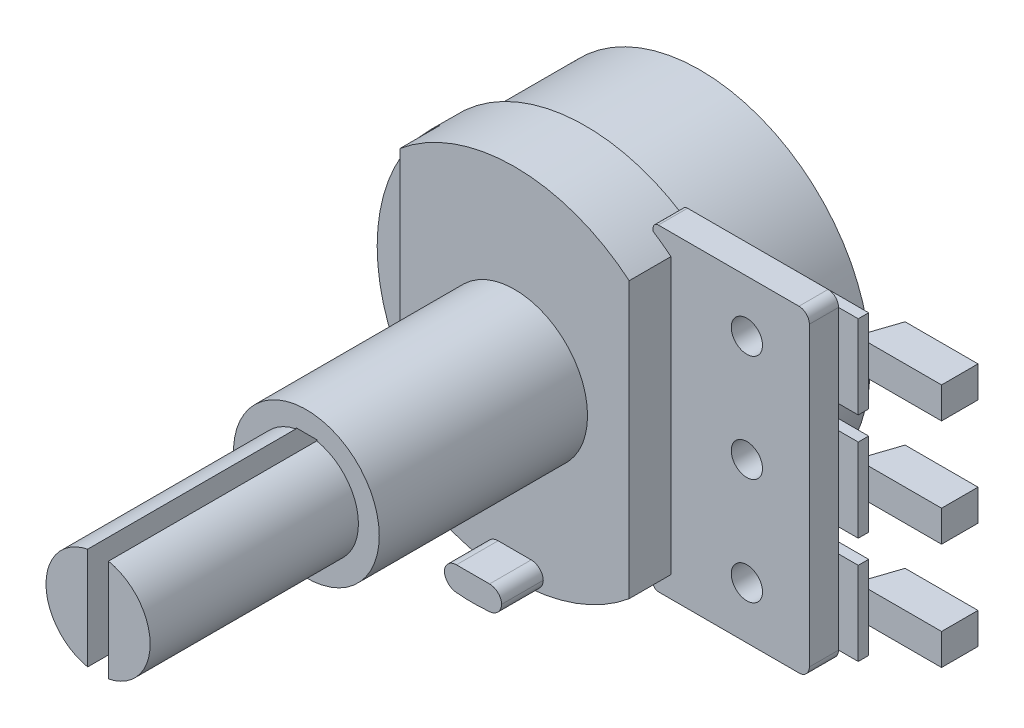
from build123d import *
from build123d.topology import SkipClean

# Parameters (mm, degrees)
SKETCH_2_R          = 8.175
EXTRUDE_1_DEPTH     = 5.5
EXTRUDE_2_DEPTH     = 1.4
SKETCH_5_W          = 2.5
SKETCH_5_H          = 2.5
CUT_EXTRUDE_1_DEPTH = 2.5
EXTRUDE_3_DEPTH     = 2
SKETCH_7_R          = 3.5
EXTRUDE_4_DEPTH     = 10
SKETCH_8_R          = 2.5
EXTRUDE_5_DEPTH     = 10
SKETCH_9_W          = 1
SKETCH_9_H          = 5
CUT_EXTRUDE_5_DEPTH = 11.5
EXTRUDE_START       = 0.5
EXTRUDE_6_DEPTH     = 0.5
SKETCH_14_W         = 4
SKETCH_14_H         = 1.5
EXTRUDE_7_DEPTH     = 1.75
EXTRUDE_7_2_DEPTH   = 1.75
EXTRUDE_7_3_DEPTH   = 1.75
SKETCH_11_R         = 0.75
CUT_EXTRUDE_6_DEPTH = 1.9
CHAMFER_1_SIZE      = 1.5
CHAMFER_1_SIZE2     = 0.5
CHAMFER_2_SIZE      = 1.5
CHAMFER_2_SIZE2     = 0.5
CHAMFER_3_SIZE      = 1.5
CHAMFER_3_SIZE2     = 0.5
EXTRUDE_8_DEPTH     = 2


with BuildPart() as part:
    # Эскиз2 → Бобышка-Вытянуть1 (new body)
    with BuildSketch(Plane.XY):
        Circle(SKETCH_2_R)
    extrude(amount=EXTRUDE_1_DEPTH)

    # Эскиз3 → Бобышка-Вытянуть2 (add)
    with BuildSketch(Plane.XY.offset(5.5)):
        with BuildLine():
            Line((4.65, -7.375), (4.65, -7.234466117))
            ThreePointArc((4.65, -7.234466117), (-8.6, 0), (4.65, 7.234466117))
            Line((4.65, 7.234466117), (4.65, 7.375))
            ThreePointArc((4.65, 7.375), (4.723223305, 7.551776695), (4.9, 7.625))
            Line((4.9, 7.625), (11.65, 7.625))
            ThreePointArc((11.65, 7.625), (12.003553391, 7.478553391), (12.15, 7.125))
            Line((12.15, 7.125), (12.15, -7.125))
            ThreePointArc((12.15, -7.125), (12.003553391, -7.478553391), (11.65, -7.625))
            Line((11.65, -7.625), (4.9, -7.625))
            ThreePointArc((4.9, -7.625), (4.723223305, -7.551776695), (4.65, -7.375))
        make_face()
    extrude(amount=EXTRUDE_2_DEPTH)

    # Эскиз5 → Вырез-Вытянуть1 (cut)
    with BuildSketch(Plane(origin=(0, 0, 0), x_dir=(-1, 0, 0), z_dir=(0, 0, -1))):
        with Locations((0, -6.925)):
            Rectangle(SKETCH_5_W, SKETCH_5_H)
    extrude(amount=-CUT_EXTRUDE_1_DEPTH, mode=Mode.SUBTRACT)

    # Эскиз6 → Бобышка-Вытянуть3 (add)
    with SkipClean():  # the faces are left unmerged after this step: merging them gives an invalid solid
        with BuildSketch(Plane.XY.offset(6.9)):
            with BuildLine():
                Line((-5.5, 6.61135387), (-5.5, -6.61135387))
                ThreePointArc((-5.5, -6.61135387), (0, -8.6), (5.5, -6.61135387))
                Line((5.5, -6.61135387), (5.5, 6.61135387))
                ThreePointArc((5.5, 6.61135387), (0, 8.6), (-5.5, 6.61135387))
            make_face()
        extrude(amount=EXTRUDE_3_DEPTH)

    # Эскиз7 → Бобышка-Вытянуть4 (add)
    with SkipClean():  # the faces are left unmerged after this step: merging them gives an invalid solid
        with BuildSketch(Plane.XY.offset(8.9)):
            Circle(SKETCH_7_R)
        extrude(amount=EXTRUDE_4_DEPTH)

    # Эскиз8 → Бобышка-Вытянуть5 (add)
    with SkipClean():  # the faces are left unmerged after this step: merging them gives an invalid solid
        with BuildSketch(Plane.XY.offset(18.9)):
            Circle(SKETCH_8_R)
        extrude(amount=EXTRUDE_5_DEPTH)

    # Эскиз9 → Вырез-Вытянуть5 (cut)
    with SkipClean():  # the faces are left unmerged after this step: merging them gives an invalid solid
        with BuildSketch(Plane.XY.offset(28.9)):
            Rectangle(SKETCH_9_W, SKETCH_9_H)
        extrude(amount=-CUT_EXTRUDE_5_DEPTH, mode=Mode.SUBTRACT)

    # Эскиз12 → Бобышка-Вытянуть6 (add)
    with SkipClean():  # the faces are left unmerged after this step: merging them gives an invalid solid
        with BuildSketch(Plane(origin=(0, 0, 5.5), x_dir=(-1, 0, 0), z_dir=(0, 0, -1)).offset(EXTRUDE_START)):
            with BuildLine():
                Line((-9.15, -2), (-13.095809491, -2))
                Line((-13.095809491, -2), (-13.095809491, 2))
                Line((-13.095809491, 2), (-9.15, 2))
                ThreePointArc((-9.15, 2), (-8.551799079, 1.908443255), (-8.008367486, 1.642155658))
                ThreePointArc((-8.008367486, 1.642155658), (-8.175, 0), (-8.008367486, -1.642155658))
                ThreePointArc((-8.008367486, -1.642155658), (-8.551799079, -1.908443255), (-9.15, -2))
            make_face()
            with BuildLine():
                Line((-9.15, 7.125860343), (-13.095809491, 7.125860343))
                Line((-13.095809491, 7.125860343), (-13.095809491, 3.125860343))
                Line((-13.095809491, 3.125860343), (-9.15, 3.125860343))
                ThreePointArc((-9.15, 3.125860343), (-7.15, 5.125860343), (-9.15, 7.125860343))
            make_face()
            with BuildLine():
                Line((-13.095809491, -3.125), (-13.095809491, -7.125))
                Line((-13.095809491, -7.125), (-9.15, -7.125))
                ThreePointArc((-9.15, -7.125), (-7.15, -5.125), (-9.15, -3.125))
                Line((-9.15, -3.125), (-13.095809491, -3.125))
            make_face()
        extrude(amount=-EXTRUDE_6_DEPTH)

    # Эскиз11 → Вырез-Вытянуть6 (cut)
    with SkipClean():  # the faces are left unmerged after this step: merging them gives an invalid solid
        with BuildSketch(Plane.XY.offset(6.9)):
            with Locations((9.15, 5.125)):
                Circle(SKETCH_11_R)
            with Locations((9.15, 0)):
                Circle(SKETCH_11_R)
            with Locations((9.15, -5.125)):
                Circle(SKETCH_11_R)
        extrude(amount=-CUT_EXTRUDE_6_DEPTH, mode=Mode.SUBTRACT)

    # Эскиз15 → Бобышка-Вытянуть8 (add)
    with SkipClean():  # the faces are left unmerged after this step: merging them gives an invalid solid
        with BuildSketch(Plane.XY.offset(8.9)):
            with BuildLine():
                Line((0.795, -7.35), (-0.795, -7.35))
                ThreePointArc((-0.795, -7.35), (-1.197101063, -7.512011083), (-1.374564786, -7.907535396))
                ThreePointArc((-1.374564786, -7.907535396), (-1.20593337, -8.309819178), (-0.814100732, -8.501485504))
                ThreePointArc((-0.814100732, -8.501485504), (0, -8.540375622), (0.814100732, -8.501485504))
                ThreePointArc((0.814100732, -8.501485504), (1.20593337, -8.309819178), (1.374564786, -7.907535396))
                ThreePointArc((1.374564786, -7.907535396), (1.197101063, -7.512011083), (0.795, -7.35))
            make_face()
        extrude(amount=EXTRUDE_8_DEPTH)


with BuildPart() as body_2:
    # Эскиз14 → Бобышка-Вытянуть7 (new body)
    with BuildSketch(Plane(origin=(0, 0, 5), x_dir=(-1, 0, 0), z_dir=(0, 0, -1))):
        with Locations((-14.595809491, 5.125860343)):
            Rectangle(SKETCH_14_W, SKETCH_14_H)
    extrude(amount=EXTRUDE_7_DEPTH)

    # Фаска1
    chamfer_1_edges = [body_2.edges().sort_by_distance(p)[0] for p in [
        (12.595809491, 5.125860343, 3.25),
    ]]
    chamfer_1_side = [body_2.faces().sort_by_distance(p)[0] for p in [
        (12.595809491, 5.125860343, 4.125),
    ]]
    chamfer(chamfer_1_edges, length=CHAMFER_1_SIZE, length2=CHAMFER_1_SIZE2, reference=chamfer_1_side[0])


with BuildPart() as body_3:
    # Эскиз14 → Extrude 7 2 (new body)
    with BuildSketch(Plane(origin=(0, 0, 5), x_dir=(-1, 0, 0), z_dir=(0, 0, -1))):
        with Locations((-14.595809491, 0)):
            Rectangle(SKETCH_14_W, SKETCH_14_H)
    extrude(amount=EXTRUDE_7_2_DEPTH)

    # Фаска2
    chamfer_2_edges = [body_3.edges().sort_by_distance(p)[0] for p in [
        (12.595809491, 0, 3.25),
    ]]
    chamfer_2_side = [body_3.faces().sort_by_distance(p)[0] for p in [
        (12.595809491, 0, 4.125),
    ]]
    chamfer(chamfer_2_edges, length=CHAMFER_2_SIZE, length2=CHAMFER_2_SIZE2, reference=chamfer_2_side[0])


with BuildPart() as body_4:
    # Эскиз14 → Extrude 7 3 (new body)
    with BuildSketch(Plane(origin=(0, 0, 5), x_dir=(-1, 0, 0), z_dir=(0, 0, -1))):
        with Locations((-14.595809491, -5.125)):
            Rectangle(SKETCH_14_W, SKETCH_14_H)
    extrude(amount=EXTRUDE_7_3_DEPTH)

    # Фаска3
    chamfer_3_edges = [body_4.edges().sort_by_distance(p)[0] for p in [
        (12.595809491, -5.125, 3.25),
    ]]
    chamfer_3_side = [body_4.faces().sort_by_distance(p)[0] for p in [
        (12.595809491, -5.125, 4.125),
    ]]
    chamfer(chamfer_3_edges, length=CHAMFER_3_SIZE, length2=CHAMFER_3_SIZE2, reference=chamfer_3_side[0])


solid = Compound([part.part, body_2.part, body_3.part, body_4.part])
